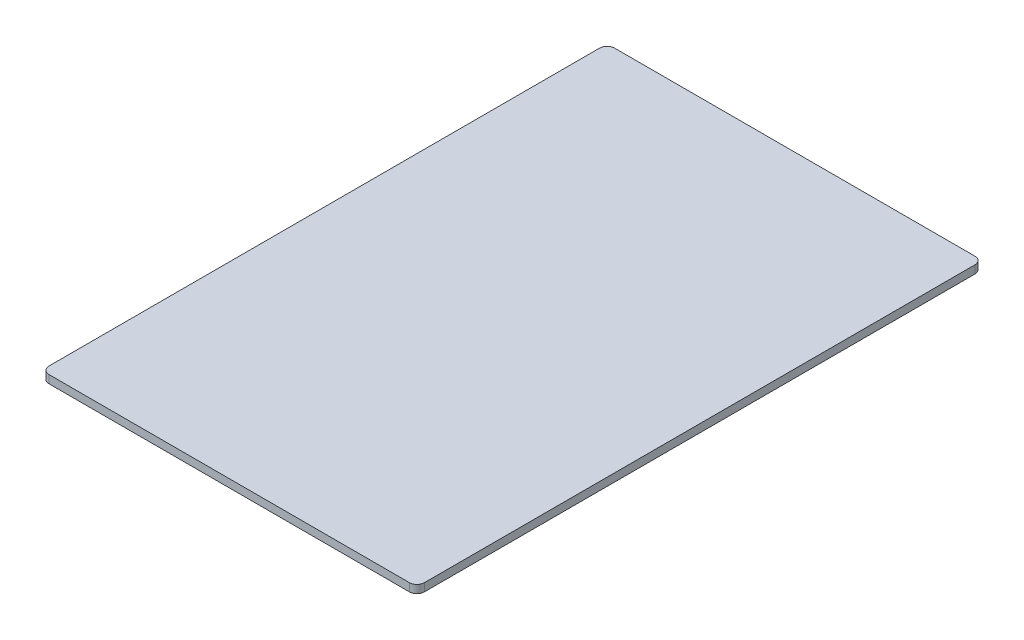
from build123d import *

# Parameters (mm, degrees)
SKETCH_1_W      = 75
SKETCH_1_H      = 113
EXTRUDE_1_DEPTH = 1.6
FILLET_1_R      = 1.5


with BuildPart() as part:
    # 草图1 → 凸台-拉伸1 (new body)
    with BuildSketch(Plane(origin=(0, 0, 0), x_dir=(1, 0, 0), z_dir=(0, 1, 0))):
        with Locations((62.780625722, -56.5)):
            Rectangle(SKETCH_1_W, SKETCH_1_H)
    extrude(amount=EXTRUDE_1_DEPTH)

    # 圆角1
    fillet_1_edges = [part.edges().sort_by_distance(p)[0] for p in [
        (25.280625722, 0.8, 0),
        (100.280625722, 0.8, 0),
        (100.280625722, 0.8, 113),
        (25.280625722, 0.8, 113),
    ]]
    fillet(fillet_1_edges, radius=FILLET_1_R)


solid = part.part
